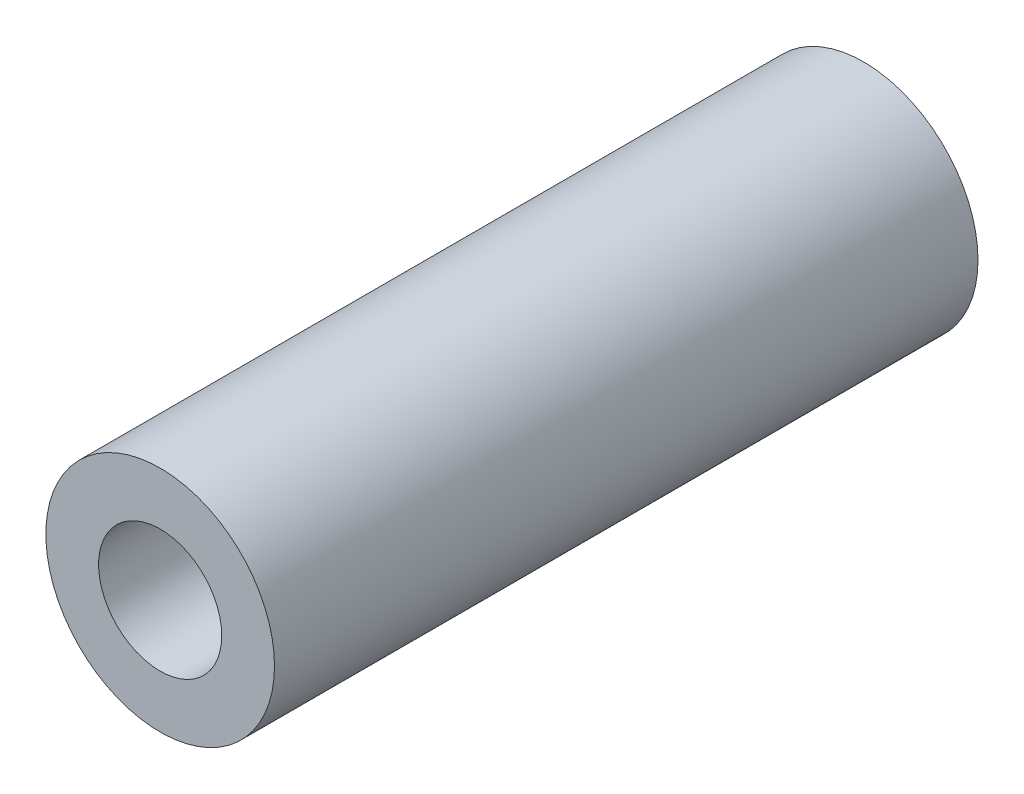
from build123d import *

# Parameters (mm, degrees)
SKETCH1_R           = 3.25
SKETCH1_R_2         = 1.75
BOSS_EXTRUDE1_DEPTH = 20


with BuildPart() as part:
    # Sketch1 → Boss-Extrude1 (new body)
    with BuildSketch(Plane.XY):
        Circle(SKETCH1_R)
        Circle(SKETCH1_R_2, mode=Mode.SUBTRACT)
    extrude(amount=BOSS_EXTRUDE1_DEPTH)


solid = part.part
